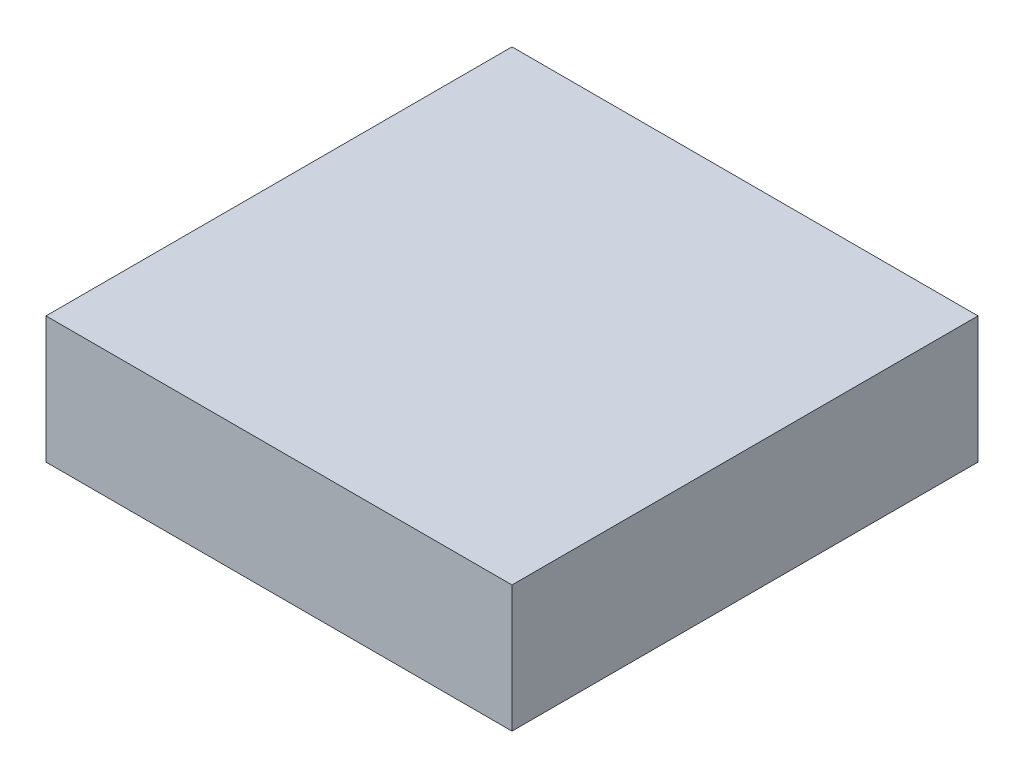
from build123d import *

# Parameters (mm, degrees)
SKETCH_1_W      = 92
SKETCH_1_H      = 92
EXTRUDE_1_DEPTH = 25


with BuildPart() as part:
    # 草图1 → 凸台-拉伸1 (new body)
    with BuildSketch(Plane(origin=(0, 0, 0), x_dir=(1, 0, 0), z_dir=(0, 1, 0))):
        with Locations((46, 46)):
            Rectangle(SKETCH_1_W, SKETCH_1_H)
    extrude(amount=EXTRUDE_1_DEPTH)


solid = part.part
